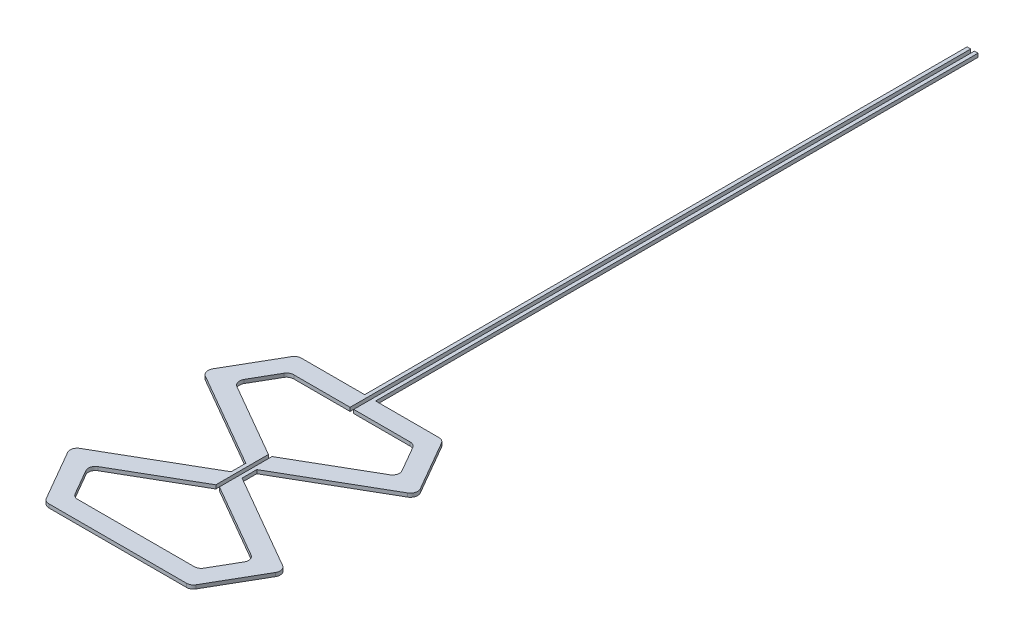
from build123d import *

# Parameters (mm, degrees)
EXTRUDE_3_DEPTH          = 1
EXTRUDE_3_2_DEPTH        = 1
CUT_EXTRUDE_3_DEPTH      = 2
CUT_EXTRUDE_3_DEPTH_BACK = 2
SKETCH_3_W               = 1
SKETCH_3_H               = 57.878930007
SKETCH_4_W               = 1
SKETCH_4_H               = 165.358983849
EXTRUDE_4_DEPTH          = 1


with BuildPart() as part:
    # 草图2 → 凸台-拉伸3 (new body)
    with BuildSketch(Plane(origin=(0, 0, 0), x_dir=(1, 0, 0), z_dir=(0, 1, 0))):
        with BuildLine():
            Line((28.5, 19.918584287), (20.577350269, 33.641016151))
            ThreePointArc((20.577350269, 33.641016151), (19.845299462, 34.373066959), (18.845299462, 34.641016151))
            Line((18.845299462, 34.641016151), (-18.845299462, 34.641016151))
            ThreePointArc((-18.845299462, 34.641016151), (-19.845299462, 34.373066959), (-20.577350269, 33.641016151))
            Line((-20.577350269, 33.641016151), (-28.5, 19.918584287))
            ThreePointArc((-28.5, 19.918584287), (-28.699800845, 18.400946197), (-27.767949192, 17.186533479))
            Line((-27.767949192, 17.186533479), (0, 1.154700538))
            Line((0, 1.154700538), (27.767949192, 17.186533479))
            ThreePointArc((27.767949192, 17.186533479), (28.699800845, 18.400946197), (28.5, 19.918584287))
        make_face()
        with BuildLine():
            Line((15.958548116, 29.641016151), (-15.958548116, 29.641016151))
            ThreePointArc((-15.958548116, 29.641016151), (-16.958548116, 29.373066959), (-17.690598923, 28.641016151))
            Line((-17.690598923, 28.641016151), (-21.669872981, 21.748711306))
            ThreePointArc((-21.669872981, 21.748711306), (-21.869673826, 20.231073216), (-20.937822174, 19.016660498))
            Line((-20.937822174, 19.016660498), (0, 6.92820323))
            Line((0, 6.92820323), (21.026102441, 19.067629134))
            ThreePointArc((21.026102441, 19.067629134), (21.910458886, 20.220144892), (21.720841617, 21.660431039))
            Line((21.720841617, 21.660431039), (17.690598923, 28.641016151))
            ThreePointArc((17.690598923, 28.641016151), (16.958548116, 29.373066959), (15.958548116, 29.641016151))
        make_face(mode=Mode.SUBTRACT)
    extrude(amount=EXTRUDE_3_DEPTH)


with BuildPart() as body_2:
    # 草图2 → Extrude 3 2 (new body)
    with BuildSketch(Plane(origin=(0, 0, 0), x_dir=(1, 0, 0), z_dir=(0, 1, 0))):
        with BuildLine():
            Line((-28.550968636, -19.83030402), (-20.547923514, -33.691984787))
            ThreePointArc((-20.547923514, -33.691984787), (-19.853184337, -34.386723964), (-18.904152973, -34.641016151))
            Line((-18.904152973, -34.641016151), (18.904152973, -34.641016151))
            ThreePointArc((18.904152973, -34.641016151), (19.853184337, -34.386723964), (20.547923514, -33.691984787))
            Line((20.547923514, -33.691984787), (28.550968636, -19.83030402))
            ThreePointArc((28.550968636, -19.83030402), (28.740585904, -18.390017873), (27.856229459, -17.237502115))
            Line((27.856229459, -17.237502115), (0, -1.154700538))
            Line((0, -1.154700538), (-27.856229459, -17.237502115))
            ThreePointArc((-27.856229459, -17.237502115), (-28.740585904, -18.390017873), (-28.550968636, -19.83030402))
        make_face()
        with BuildLine():
            Line((-21.026102441, -19.067629134), (0, -6.92820323))
            Line((0, -6.92820323), (21.026102441, -19.067629134))
            ThreePointArc((21.026102441, -19.067629134), (21.910458886, -20.220144892), (21.720841617, -21.660431039))
            Line((21.720841617, -21.660431039), (17.661172168, -28.691984787))
            ThreePointArc((17.661172168, -28.691984787), (16.966432991, -29.386723964), (16.017401627, -29.641016151))
            Line((16.017401627, -29.641016151), (-16.017401627, -29.641016151))
            ThreePointArc((-16.017401627, -29.641016151), (-16.966432991, -29.386723964), (-17.661172168, -28.691984787))
            Line((-17.661172168, -28.691984787), (-21.720841617, -21.660431039))
            ThreePointArc((-21.720841617, -21.660431039), (-21.910458886, -20.220144892), (-21.026102441, -19.067629134))
        make_face(mode=Mode.SUBTRACT)
    extrude(amount=EXTRUDE_3_2_DEPTH)


with BuildPart() as cut_extrude_3_tool:
    # 草图3 → 切除-拉伸3 (new, two sides: drawn at the far end of the back side and taken through both)
    with BuildSketch(Plane(origin=(0, 0, 0), x_dir=(1, 0, 0), z_dir=(0, 1, 0)).offset(-CUT_EXTRUDE_3_DEPTH_BACK)):
        with Locations((0, 6.92820323)):
            Rectangle(SKETCH_3_W, SKETCH_3_H)
    extrude(amount=CUT_EXTRUDE_3_DEPTH + CUT_EXTRUDE_3_DEPTH_BACK)


with BuildPart() as part_1:
    add(part.part)

    # 切除-拉伸3: cut by cut_extrude_3_tool
    add(cut_extrude_3_tool.part, mode=Mode.SUBTRACT)



with BuildPart() as body_2_1:
    add(body_2.part)

    # 切除-拉伸3: cut by cut_extrude_3_tool
    add(cut_extrude_3_tool.part, mode=Mode.SUBTRACT)


with BuildPart() as part_2:
    add(part_1.part)

    add(body_2_1.part)  # 凸台-拉伸4 merges body 2
    # 草图4 → 凸台-拉伸4 (add)
    with BuildSketch(Plane(origin=(0, 0, 0), x_dir=(1, 0, 0), z_dir=(0, 1, 0))):
        Polygon((-1.5, 2.020725942), (-1.5, -2.020725942), (-0.5, -1.443375673), (-0.5, 1.443375673), align=None)
        Polygon((0.5, 1.443375673), (0.5, -1.443375673), (1.5, -2.020725942), (1.5, 2.020725942), align=None)
        with Locations((-1, 117.320508076)):
            Rectangle(SKETCH_4_W, SKETCH_4_H)
        with Locations((1, 117.320508076)):
            Rectangle(SKETCH_4_W, SKETCH_4_H)
    extrude(amount=EXTRUDE_4_DEPTH)


solid = part_2.part
